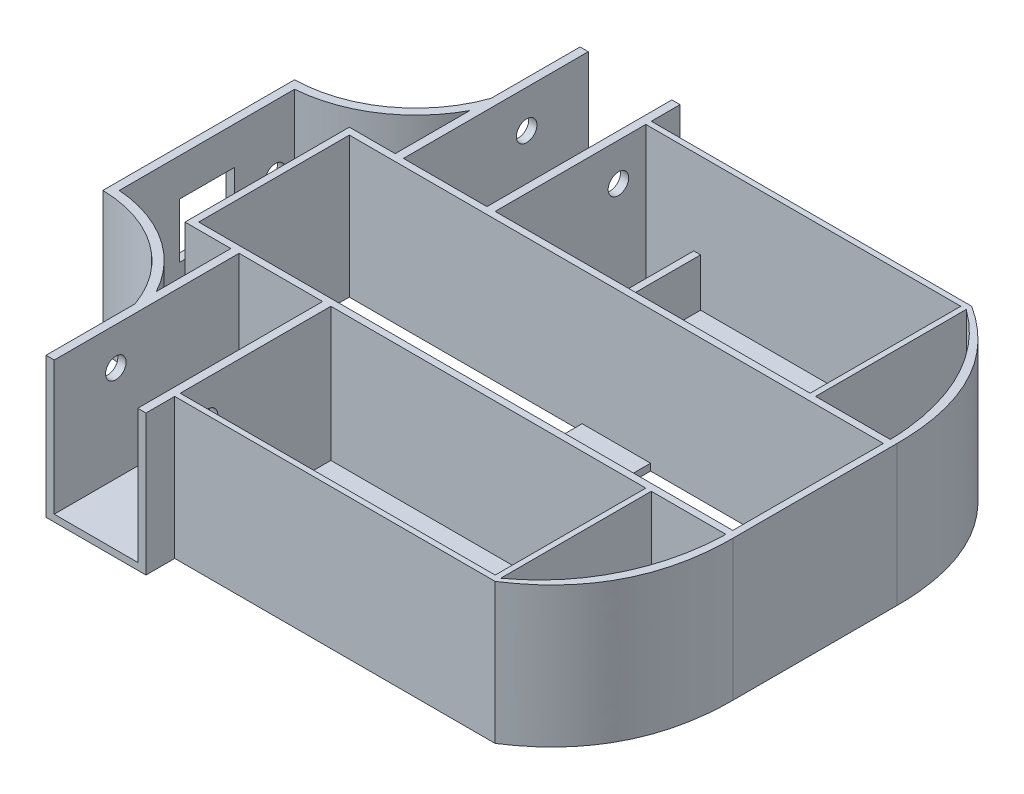
from build123d import *

# Parameters (mm, degrees)
SKETCH_2_W          = 80
SKETCH_2_H          = 24
SKETCH_2_W_2        = 78
SKETCH_2_H_2        = 22
EXTRUDE_3130_DEPTH  = 20.5
SKETCH_2_3_W        = 10
SKETCH_2_3_H        = 22
SKETCH_2_3_R        = 1.5
SKETCH_2_3_W_2      = 46
SKETCH_2_3_R_2      = 2
SKETCH_2_3_W_3      = 4
SKETCH_2_3_H_2      = 8
SKETCH_2_3_W_4      = 12.2
SKETCH_2_3_H_3      = 27
EXTRUDE_3218_DEPTH  = 1
CUT_EXTRUDE_START   = -18.7
SKETCH_3_R          = 1.5
CUT_EXTRUDE_1_DEPTH = 14.6
CUT_EXTRUDE_START_2 = -48.8
SKETCH_3_2_R        = 1.5
SKETCH_3_2_W        = 8
SKETCH_3_2_H        = 8
CUT_EXTRUDE_2_DEPTH = 1.2
SKETCH_2_5_W        = 1
SKETCH_2_5_H        = 22
EXTRUDE_4_DEPTH     = 8


with BuildPart() as part:
    # Эскиз2 → Extrude 3130 (new body)
    # profile 1 of 8: a face of its own
    with BuildSketch(Plane(origin=(0, 0, 0), x_dir=(1, 0, 0), z_dir=(0, 1, 0))):
        Rectangle(SKETCH_2_W, SKETCH_2_H)
        Rectangle(SKETCH_2_W_2, SKETCH_2_H_2, mode=Mode.SUBTRACT)
    # profile 2 of 8: a face of its own
    with BuildSketch(Plane(origin=(0, 0, 0), x_dir=(1, 0, 0), z_dir=(0, 1, 0))):
        with BuildLine():
            Line((-33.3, -39), (-32.1, -39))
            Line((-32.1, -39), (-32.1, -12))
            Line((-32.1, -12), (-33.3, -12))
            Line((-33.3, -12), (-33.3, -22.903910844))
            ThreePointArc((-33.3, -22.903910844), (-39.756802154, -15.868113034), (-48.8, -12.8))
            Line((-48.8, -12.8), (-48.8, 12.8))
            ThreePointArc((-48.8, 12.8), (-39.756802154, 15.868113034), (-33.3, 22.903910844))
            Line((-33.3, 22.903910844), (-33.3, 12))
            Line((-33.3, 12), (-32.1, 12))
            Line((-32.1, 12), (-32.1, 39))
            Line((-32.1, 39), (-33.3, 39))
            Line((-33.3, 39), (-33.3, 26))
            ThreePointArc((-33.3, 26), (-39.767640231, 17.380382655), (-50, 14))
            Line((-50, 14), (-50, -14))
            ThreePointArc((-50, -14), (-39.767640231, -17.380382655), (-33.3, -26))
            Line((-33.3, -26), (-33.3, -39))
        make_face()
    # profile 3 of 8: a face of its own
    with BuildSketch(Plane(origin=(0, 0, 0), x_dir=(1, 0, 0), z_dir=(0, 1, 0))):
        Polygon((-18.7, 34), (-18.7, 34.8), (-18.7, 39), (-19.9, 39), (-19.9, 12), (-18.7, 12), align=None)
    # profile 4 of 8: a face of its own
    with BuildSketch(Plane(origin=(0, 0, 0), x_dir=(1, 0, 0), z_dir=(0, 1, 0))):
        Polygon((-18.7, -39), (-18.7, -34.8), (-18.7, -34), (-18.7, -12), (-19.9, -12), (-19.9, -39), align=None)
    # profile 5 of 8: a face of its own
    with BuildSketch(Plane(origin=(0, 0, 0), x_dir=(1, 0, 0), z_dir=(0, 1, 0))):
        Polygon((28.1, 34), (28.1, 34.8), (-18.7, 34.8), (-18.7, 34), (-11.7, 34), (-10.7, 34), (27.3, 34), (27.3, 12), (28.1, 12), align=None)
    # profile 6 of 8: a face of its own
    with BuildSketch(Plane(origin=(0, 0, 0), x_dir=(1, 0, 0), z_dir=(0, 1, 0))):
        with BuildLine():
            Line((39, 12), (40, 12))
            add(Edge.make_bspline(
                [(28.1, 34.8), (40.01829159, 27.087388808), (40, 12)],
                knots=[0, 0, 0, 1, 1, 1], degree=2))
            Line((28.1, 34.8), (28.1, 34))
            add(Edge.make_bspline(
                [(28.1, 34), (35.667325964, 28.510032971), (38.830570785, 20.077982561), (39, 12)],
                knots=[0, 0, 0, 0, 1, 1, 1, 1], degree=3))
        make_face()
    # profile 7 of 8: a face of its own
    with BuildSketch(Plane(origin=(0, 0, 0), x_dir=(1, 0, 0), z_dir=(0, 1, 0))):
        Polygon((-18.7, -34.8), (28.1, -34.8), (28.1, -34), (28.1, -12), (27.3, -12), (27.3, -34), (-18.7, -34), align=None)
    # profile 8 of 8: a face of its own
    with BuildSketch(Plane(origin=(0, 0, 0), x_dir=(1, 0, 0), z_dir=(0, 1, 0))):
        with BuildLine():
            add(Edge.make_bspline(
                [(28.1, -34.8), (40.01829159, -27.087388808), (40, -12)],
                knots=[0, 0, 0, 1, 1, 1], degree=2))
            Line((40, -12), (39, -12))
            add(Edge.make_bspline(
                [(28.1, -34), (35.667325964, -28.510032971), (38.830570785, -20.077982561), (39, -12)],
                knots=[0, 0, 0, 0, 1, 1, 1, 1], degree=3))
            Line((28.1, -34), (28.1, -34.8))
        make_face()
    extrude(amount=EXTRUDE_3130_DEPTH)

    # Эскиз2<3> → Extrude 3218 (add)
    # profile 1 of 6: a face of its own
    with BuildSketch(Plane(origin=(0, 0, 0), x_dir=(1, 0, 0), z_dir=(0, 1, 0))):
        Rectangle(SKETCH_2_3_W, SKETCH_2_3_H)
        with Locations(Location((0, 0, 0), (0, 0, 270))):
            Circle(SKETCH_2_3_R, mode=Mode.SUBTRACT)
    # profile 2 of 6: a face of its own
    with BuildSketch(Plane(origin=(0, 0, 0), x_dir=(1, 0, 0), z_dir=(0, 1, 0))):
        with Locations((4.3, -23)):
            Rectangle(SKETCH_2_3_W_2, SKETCH_2_3_H)
        with Locations(Location((24.1, -23, 0), (0, 0, 270))):
            Circle(SKETCH_2_3_R_2, mode=Mode.SUBTRACT)
    # profile 3 of 6: a face of its own
    with BuildSketch(Plane(origin=(0, 0, 0), x_dir=(1, 0, 0), z_dir=(0, 1, 0))):
        with Locations((4.3, 23)):
            Rectangle(SKETCH_2_3_W_2, SKETCH_2_3_H)
        with Locations(Location((24.1, 23, 0), (0, 0, 270))):
            Circle(SKETCH_2_3_R_2, mode=Mode.SUBTRACT)
        with Locations(Location((-15.7, 31, 0), (0, 0, 270))):
            Circle(SKETCH_2_3_R, mode=Mode.SUBTRACT)
        with Locations(Location((-15.7, 16, 0), (0, 0, 270))):
            Circle(SKETCH_2_3_R, mode=Mode.SUBTRACT)
        with Locations((-15.7, 23.5)):
            Rectangle(SKETCH_2_3_W_3, SKETCH_2_3_H_2, mode=Mode.SUBTRACT)
    # profile 4 of 6: a face of its own
    with BuildSketch(Plane(origin=(0, 0, 0), x_dir=(1, 0, 0), z_dir=(0, 1, 0))):
        with Locations((-26, -25.5)):
            Rectangle(SKETCH_2_3_W_4, SKETCH_2_3_H_3)
    # profile 5 of 6: a face of its own
    with BuildSketch(Plane(origin=(0, 0, 0), x_dir=(1, 0, 0), z_dir=(0, 1, 0))):
        with Locations((-26, 25.5)):
            Rectangle(SKETCH_2_3_W_4, SKETCH_2_3_H_3)
    # profile 6 of 6: a face of its own
    with BuildSketch(Plane(origin=(0, 0, 0), x_dir=(1, 0, 0), z_dir=(0, 1, 0))):
        with BuildLine():
            Line((-33.3, -22.903910844), (-33.3, -12))
            Line((-33.3, -12), (-40, -12))
            Line((-40, -12), (-40, 12))
            Line((-40, 12), (-33.3, 12))
            Line((-33.3, 12), (-33.3, 22.903910844))
            ThreePointArc((-33.3, 22.903910844), (-39.756802154, 15.868113034), (-48.8, 12.8))
            Line((-48.8, 12.8), (-48.8, -12.8))
            ThreePointArc((-48.8, -12.8), (-39.756802154, -15.868113034), (-33.3, -22.903910844))
        make_face()
    extrude(amount=EXTRUDE_3218_DEPTH)

    # Эскиз3 → Вырез-Вытянуть1 (cut)
    with BuildSketch(Plane(origin=(0, 0, 0), x_dir=(0, 0, -1), z_dir=(1, 0, 0)).offset(CUT_EXTRUDE_START)):
        with Locations((-30, 15)):
            Circle(SKETCH_3_R)
        with Locations((30, 15)):
            Circle(SKETCH_3_R)
    extrude(amount=-CUT_EXTRUDE_1_DEPTH, mode=Mode.SUBTRACT)

    # Эскиз3<2> → Вырез-Вытянуть2 (cut)
    with BuildSketch(Plane(origin=(0, 0, 0), x_dir=(0, 0, -1), z_dir=(1, 0, 0)).offset(CUT_EXTRUDE_START_2)):
        with Locations((30, 15)):
            Circle(SKETCH_3_2_R)
        with Locations((-30, 15)):
            Circle(SKETCH_3_2_R)
        with Locations((-10, 11)):
            Circle(SKETCH_3_2_R)
        with Locations((10, 11)):
            Circle(SKETCH_3_2_R)
        with Locations((0, 11)):
            Rectangle(SKETCH_3_2_W, SKETCH_3_2_H)
    extrude(amount=-CUT_EXTRUDE_2_DEPTH, mode=Mode.SUBTRACT)

    # Эскиз2<5> → Бобышка-Вытянуть4 (add)
    with BuildSketch(Plane(origin=(0, 0, 0), x_dir=(1, 0, 0), z_dir=(0, 1, 0))):
        with Locations((-11.2, 23)):
            Rectangle(SKETCH_2_5_W, SKETCH_2_5_H)
    extrude(amount=EXTRUDE_4_DEPTH)


solid = part.part
